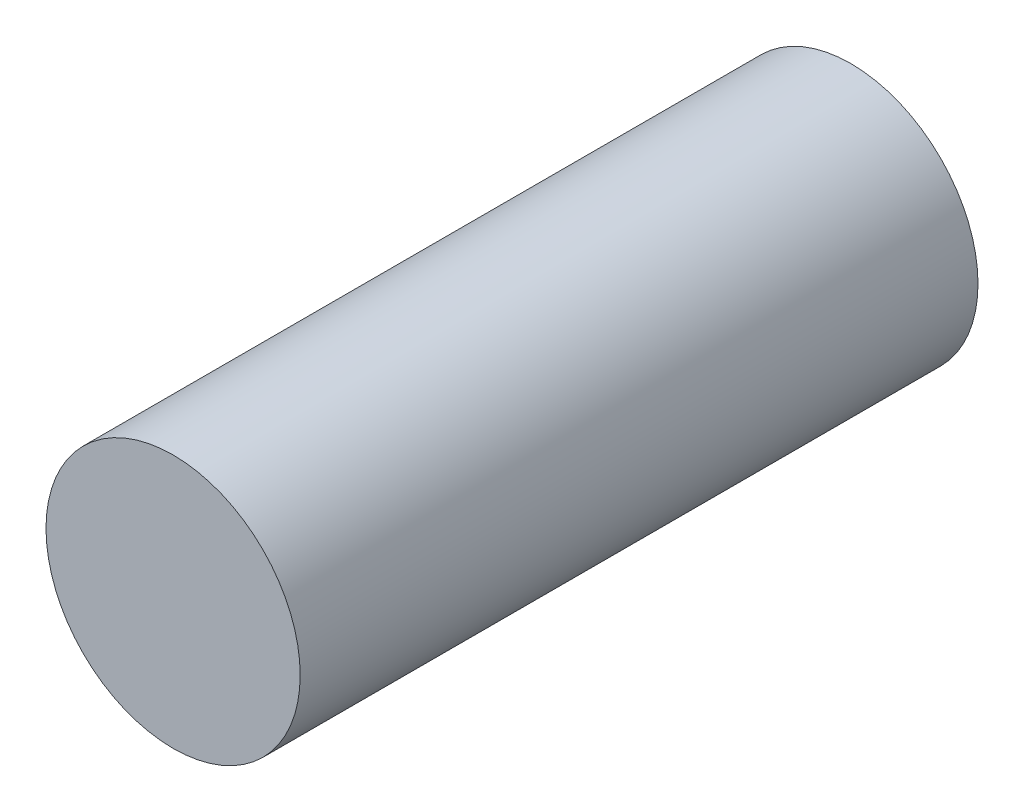
from build123d import *

# Parameters (mm, degrees)
SKETCH2_R           = 7.62
BOSS_EXTRUDE1_DEPTH = 40.64


with BuildPart() as part:
    # Sketch2 → Boss-Extrude1 (new body)
    with BuildSketch(Plane(origin=(0, 0, 0), x_dir=(0, 1, 0), z_dir=(0, 0, 1))):
        with Locations(Location((0, 0, 0), (0, 0, 270))):
            Circle(SKETCH2_R)
    extrude(amount=BOSS_EXTRUDE1_DEPTH)


solid = part.part
